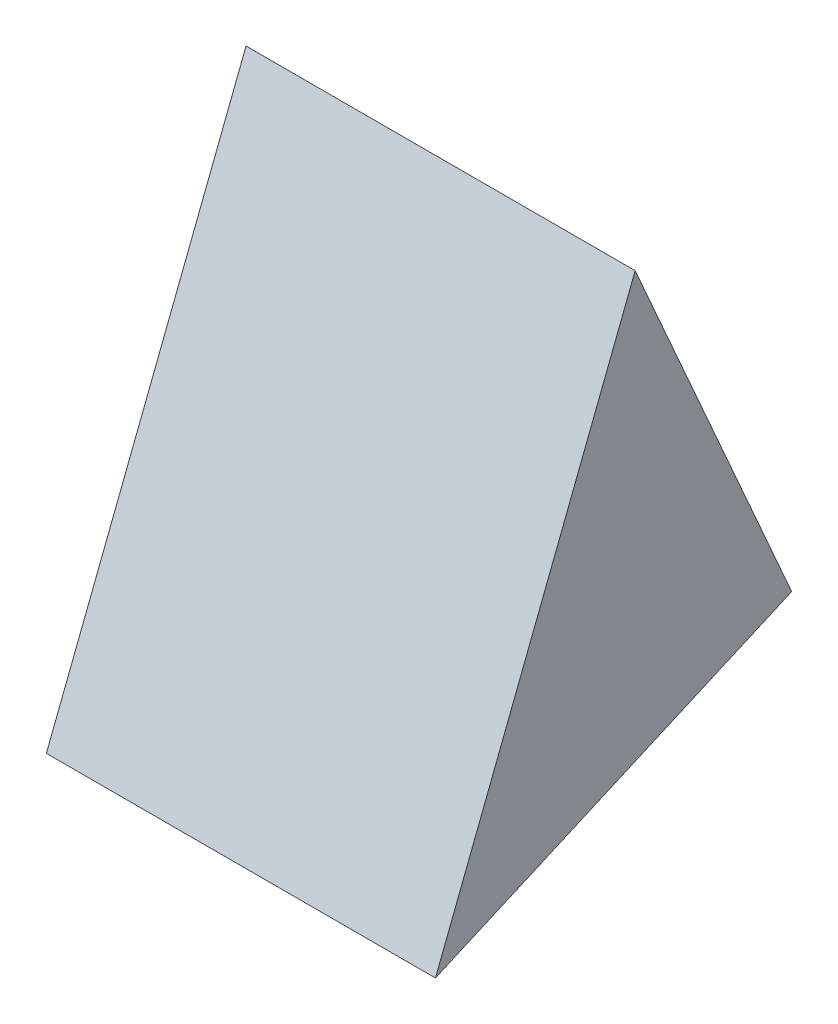
from build123d import *

# Parameters (mm, degrees)
BOSS_EXTRUDE1_DEPTH = 30


with BuildPart() as part:
    # Sketch1 → Boss-Extrude1 (new body)
    with BuildSketch(Plane(origin=(0, 0, 0), x_dir=(0, 0, -1), z_dir=(1, 0, 0))):
        Polygon((-17.1747698, 16.857676036), (-32.572768664, -22.675874664), (-5.106993882, -10.608098746), align=None)
    extrude(amount=BOSS_EXTRUDE1_DEPTH)


solid = part.part
